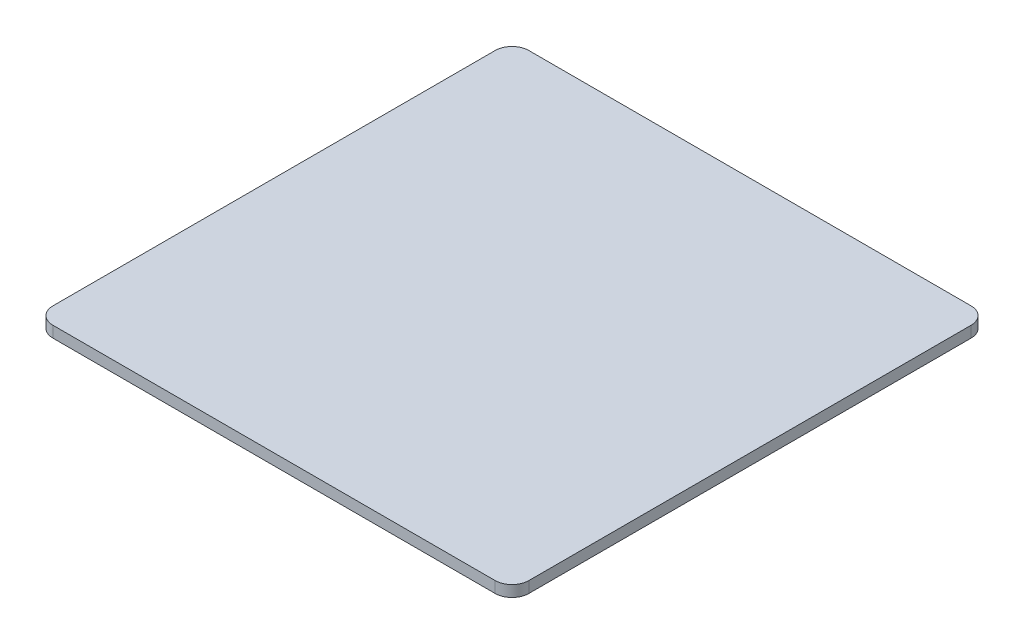
from build123d import *

# Parameters (mm, degrees)
SKETCH1_W           = 85
SKETCH1_H           = 85
BOSS_EXTRUDE1_DEPTH = 2
FILLET1_R           = 3


with BuildPart() as part:
    # Sketch1 → Boss-Extrude1 (new body)
    with BuildSketch(Plane(origin=(0, 0, 0), x_dir=(1, 0, 0), z_dir=(0, 1, 0))):
        Rectangle(SKETCH1_W, SKETCH1_H)
    extrude(amount=BOSS_EXTRUDE1_DEPTH)

    # Fillet1
    fillet1_edges = [part.edges().sort_by_distance(p)[0] for p in [
        (42.5, 1, 42.5),
        (-42.5, 1, 42.5),
        (-42.5, 1, -42.5),
        (42.5, 1, -42.5),
    ]]
    fillet(fillet1_edges, radius=FILLET1_R)


solid = part.part
